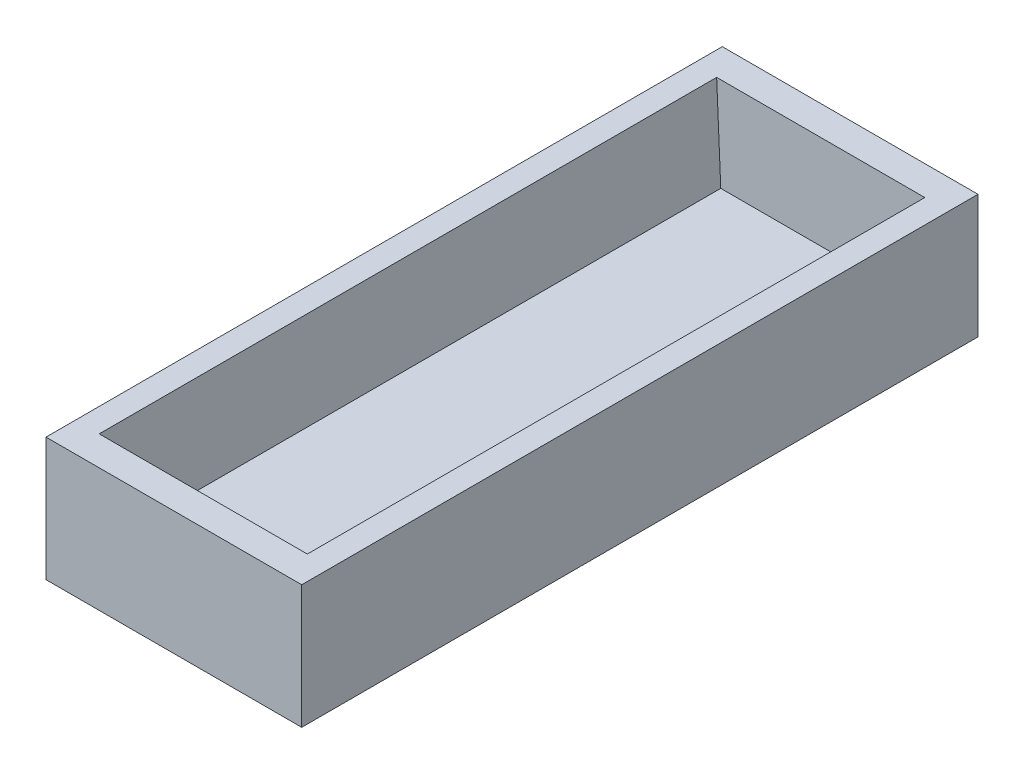
from build123d import *

# Parameters (mm, degrees)
BOSS_EXTRUDE1_DEPTH = 146.05
BOSS_EXTRUDE2_DEPTH = 6.35
SKETCH3_W           = 274.391313821
SKETCH3_H           = 212.158232336
CUT_EXTRUDE1_DEPTH  = 81.28
SKETCH4_W           = 56.814403599
SKETCH4_H           = 146.05
SKETCH4_W_2         = 112.041307198
CUT_EXTRUDE2_DEPTH  = 269.802733384


with BuildPart() as part:
    # Sketch1 → Boss-Extrude1 (new body)
    with BuildSketch(Plane.XY):
        Polygon((0, 0), (0, 107.95), (3.175, 107.95), (7.6109518, 6.35), (50.7909518, 6.35), (55.226903599, 107.95), (58.401903599, 107.95), (62.837855399, 6.35), (106.017855399, 6.35), (110.453807198, 107.95), (113.628807198, 107.95), (118.064758998, 6.35), (161.244758998, 6.35), (165.680710797, 107.95), (168.855710797, 107.95), (173.291662597, 6.35), (216.471662597, 6.35), (220.907614396, 107.95), (224.082614396, 107.95), (224.082614396, 0), align=None)
    extrude(amount=BOSS_EXTRUDE1_DEPTH)

    # Sketch2 → Boss-Extrude2 (add)
    with BuildSketch(Plane.XY.offset(146.05)):
        Polygon((3.175, 107.95), (55.226903599, 107.95), (50.7909518, 6.35), (7.6109518, 6.35), align=None)
        Polygon((58.401903599, 107.95), (62.837855399, 6.35), (106.017855399, 6.35), (110.453807198, 107.95), align=None)
        Polygon((113.628807198, 107.95), (118.064758998, 6.35), (161.244758998, 6.35), (165.680710797, 107.95), align=None)
        Polygon((168.855710797, 107.95), (173.291662597, 6.35), (216.471662597, 6.35), (220.907614396, 107.95), align=None)
    boss_extrude2 = extrude(amount=-BOSS_EXTRUDE2_DEPTH)

    # Mirror1: Boss-Extrude2 across plane
    add(boss_extrude2.mirror(Plane(origin=(0, 0, 73.025), x_dir=(1, 0, 0), z_dir=(0, 0, -1))))

    # Sketch3 → Cut-Extrude1 (cut)
    with BuildSketch(Plane(origin=(0, 107.95, 0), x_dir=(1, 0, 0), z_dir=(0, 1, 0))):
        with Locations((112.984880501, -67.937773638)):
            Rectangle(SKETCH3_W, SKETCH3_H)
    extrude(amount=-CUT_EXTRUDE1_DEPTH, mode=Mode.SUBTRACT)

    # Sketch4 → Cut-Extrude2 (cut, through all)
    with BuildSketch(Plane(origin=(0, 26.67, 0), x_dir=(1, 0, 0), z_dir=(0, 1, 0))):
        with Locations((28.4072018, -73.025)):
            Rectangle(SKETCH4_W, SKETCH4_H)
        with Locations((168.061960797, -73.025)):
            Rectangle(SKETCH4_W_2, SKETCH4_H)
    extrude(amount=-CUT_EXTRUDE2_DEPTH, mode=Mode.SUBTRACT)


solid = part.part
